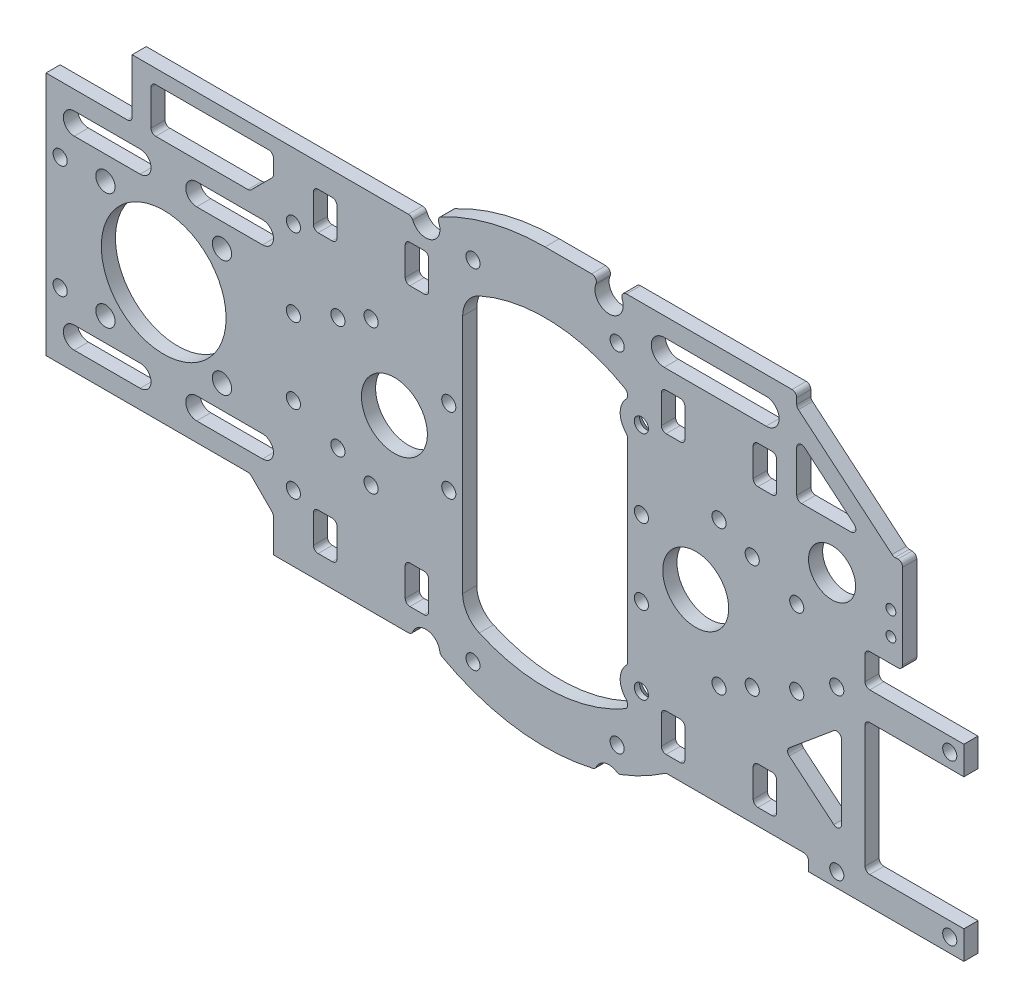
from build123d import *

# Parameters (mm, degrees)
SKETCH_1_R                  = 13.25
SKETCH_1_R_2                = 2.05
SKETCH_1_R_3                = 1.5
SKETCH_1_R_4                = 1.05
SKETCH_1_R_5                = 7
SKETCH_1_R_6                = 5
SKETCH_1_W                  = 5
SKETCH_1_H                  = 8
SKETCH_1_W_2                = 26
SKETCH_1_H_2                = 9.5
EXTRUDE_1_DEPTH             = 3
HOLE_WIZARD_M3_1_AT_2_COUNT = 2
HOLE_WIZARD_M3_1_AT_2_PITCH = 49
FILLET_2_R                  = 6
CHAMFER_1_SIZE              = 5
FILLET_1_R                  = 1
SKETCH_3_R                  = 3
CUT_EXTRUDE_1_DEPTH         = 10
FILLET_3_R                  = 1


with BuildPart() as part:
    # 草图1 → 凸台-拉伸1 (new body)
    with BuildSketch(Plane.XY):
        with BuildLine():
            Line((-106, -26), (-57.705, -26))
            Line((-57.705, -26), (-57.705, -38.5))
            Line((-57.705, -38.5), (-23.296995514, -38.5))
            ThreePointArc((-23.296995514, -38.5), (1.418755187, -44.977629259), (25.677121627, -36.9551813))
            Line((25.677121627, -36.9551813), (55.955, -36.9551813))
            Line((55.955, -36.9551813), (55.955, -39.9551813))
            Line((55.955, -39.9551813), (88.955, -39.9551813))
            Line((88.955, -39.9551813), (88.955, -33.9551813))
            Line((88.955, -33.9551813), (67.955, -33.9551813))
            Line((67.955, -33.9551813), (67.955, -22.9551813))
            Line((67.955, -22.9551813), (67.955, -6))
            Line((67.955, -6), (88.955, -6))
            Line((88.955, -6), (88.955, 0))
            Line((88.955, 0), (82.821810834, 0))
            Line((82.821810834, 0), (67.955, 0))
            Line((67.955, 0), (67.955, 7.0448187))
            Line((67.955, 7.0448187), (75.955, 7.0448187))
            Line((75.955, 7.0448187), (75.955, 12.0448187))
            Line((75.955, 12.0448187), (75.955, 27.0448187))
            Line((75.955, 27.0448187), (73.978938419, 27.0448187))
            Line((73.978938419, 27.0448187), (53.455, 44.266447857))
            Line((53.455, 44.266447857), (53.455, 47))
            Line((53.455, 47), (0, 47))
            ThreePointArc((0, 47), (-14.133294025, 44.824658392), (-26.958301133, 38.5))
            Line((-26.958301133, 38.5), (-57.705, 38.5))
            Line((-57.705, 38.5), (-87.705, 38.5))
            Line((-87.705, 38.5), (-87.705, 26))
            Line((-87.705, 26), (-106, 26))
            Line((-106, 26), (-106, -26))
        make_face()
        with Locations((-81, 0)):
            Circle(SKETCH_1_R, mode=Mode.SUBTRACT)
        with Locations((-93.374368671, 12.374368671)):
            Circle(SKETCH_1_R_2, mode=Mode.SUBTRACT)
        with Locations((-68.625631329, 12.374368671)):
            Circle(SKETCH_1_R_2, mode=Mode.SUBTRACT)
        with Locations((-68.625631329, -12.374368671)):
            Circle(SKETCH_1_R_2, mode=Mode.SUBTRACT)
        with Locations((-93.374368671, -12.374368671)):
            Circle(SKETCH_1_R_2, mode=Mode.SUBTRACT)
        with Locations((-20.455, 8)):
            Circle(SKETCH_1_R_3, mode=Mode.SUBTRACT)
        with Locations((-20.455, -8)):
            Circle(SKETCH_1_R_3, mode=Mode.SUBTRACT)
        with Locations((-53.455, 8)):
            Circle(SKETCH_1_R_3, mode=Mode.SUBTRACT)
        with Locations((-53.455, -8)):
            Circle(SKETCH_1_R_3, mode=Mode.SUBTRACT)
        with Locations(Location((20.455, -8, 0), (0, 0, 180))):
            Circle(SKETCH_1_R_3, mode=Mode.SUBTRACT)
        with Locations(Location((20.455, 8, 0), (0, 0, 180))):
            Circle(SKETCH_1_R_3, mode=Mode.SUBTRACT)
        with Locations(Location((53.455, -8, 0), (0, 0, 180))):
            Circle(SKETCH_1_R_3, mode=Mode.SUBTRACT)
        with Locations(Location((53.455, 8, 0), (0, 0, 180))):
            Circle(SKETCH_1_R_3, mode=Mode.SUBTRACT)
        with Locations((-36.955, 15.3)):
            Circle(SKETCH_1_R_3, mode=Mode.SUBTRACT)
        with Locations((-36.955, -15.3)):
            Circle(SKETCH_1_R_3, mode=Mode.SUBTRACT)
        with Locations(Location((36.955, -15.3, 0), (0, 0, 180))):
            Circle(SKETCH_1_R_3, mode=Mode.SUBTRACT)
        with Locations(Location((36.955, 15.3, 0), (0, 0, 180))):
            Circle(SKETCH_1_R_3, mode=Mode.SUBTRACT)
        with Locations((-15.307337295, 36.9551813)):
            Circle(SKETCH_1_R_3, mode=Mode.SUBTRACT)
        with Locations(Location((-15.307337295, -36.9551813, 0), (0, 0, 180))):
            Circle(SKETCH_1_R_3, mode=Mode.SUBTRACT)
        with Locations((15.307337295, -36.9551813)):
            Circle(SKETCH_1_R_3, mode=Mode.SUBTRACT)
        with Locations(Location((15.307337295, 36.9551813, 0), (0, 0, 180))):
            Circle(SKETCH_1_R_3, mode=Mode.SUBTRACT)
        with Locations((44, 12)):
            Circle(SKETCH_1_R_3, mode=Mode.SUBTRACT)
        with Locations((44, -12)):
            Circle(SKETCH_1_R_3, mode=Mode.SUBTRACT)
        with Locations((-44, 12)):
            Circle(SKETCH_1_R_3, mode=Mode.SUBTRACT)
        with Locations((-44, -12)):
            Circle(SKETCH_1_R_3, mode=Mode.SUBTRACT)
        with Locations((-53.455, 24.5)):
            Circle(SKETCH_1_R_3, mode=Mode.SUBTRACT)
        with Locations(Location((-53.455, -24.5, 0), (0, 0, 180))):
            Circle(SKETCH_1_R_3, mode=Mode.SUBTRACT)
        with Locations((20.455, -24.5)):
            Circle(SKETCH_1_R_3, mode=Mode.SUBTRACT)
        with Locations(Location((20.455, 24.5, 0), (0, 0, 180))):
            Circle(SKETCH_1_R_3, mode=Mode.SUBTRACT)
        with Locations((-103, 12)):
            Circle(SKETCH_1_R_3, mode=Mode.SUBTRACT)
        with Locations(Location((-103, -12, 0), (0, 0, 180))):
            Circle(SKETCH_1_R_3, mode=Mode.SUBTRACT)
        with Locations((61.955, -36.9551813)):
            Circle(SKETCH_1_R_3, mode=Mode.SUBTRACT)
        with Locations((61.955, -2.9551813)):
            Circle(SKETCH_1_R_3, mode=Mode.SUBTRACT)
        with Locations((73.455, 12)):
            Circle(SKETCH_1_R_4, mode=Mode.SUBTRACT)
        with Locations((73.455, 17)):
            Circle(SKETCH_1_R_4, mode=Mode.SUBTRACT)
        with Locations((85.955, -36.9551813)):
            Circle(SKETCH_1_R_3, mode=Mode.SUBTRACT)
        with Locations((85.955, -2.9551813)):
            Circle(SKETCH_1_R_3, mode=Mode.SUBTRACT)
        with Locations((32, 0)):
            Circle(SKETCH_1_R_5, mode=Mode.SUBTRACT)
        with Locations(Location((-32, 0, 0), (0, 0, 180))):
            Circle(SKETCH_1_R_5, mode=Mode.SUBTRACT)
        with Locations((60.955, 17.5448187)):
            Circle(SKETCH_1_R_6, mode=Mode.SUBTRACT)
        with BuildLine():
            Line((-17.5, 29.150471694), (-17.5, -29.150471694))
            ThreePointArc((-17.5, -29.150471694), (0, -34), (17.5, -29.150471694))
            Line((17.5, -29.150471694), (17.5, -27.893814226))
            ThreePointArc((17.5, -27.893814226), (15.955, -24.5), (17.5, -21.106185774))
            Line((17.5, -21.106185774), (17.5, 21.106185774))
            ThreePointArc((17.5, 21.106185774), (15.955, 24.5), (17.5, 27.893814226))
            Line((17.5, 27.893814226), (17.5, 29.150471694))
            ThreePointArc((17.5, 29.150471694), (0, 34), (-17.5, 29.150471694))
        make_face(mode=Mode.SUBTRACT)
        with Locations((-27.205, -29.5)):
            Rectangle(SKETCH_1_W, SKETCH_1_H, mode=Mode.SUBTRACT)
        with Locations((-46.705, -29.5)):
            Rectangle(SKETCH_1_W, SKETCH_1_H, mode=Mode.SUBTRACT)
        with Locations((-27.205, 29.5)):
            Rectangle(SKETCH_1_W, SKETCH_1_H, mode=Mode.SUBTRACT)
        with Locations((-46.705, 29.5)):
            Rectangle(SKETCH_1_W, SKETCH_1_H, mode=Mode.SUBTRACT)
        with Locations((27.205, 29.5)):
            Rectangle(SKETCH_1_W, SKETCH_1_H, mode=Mode.SUBTRACT)
        with Locations((46.705, 29.5)):
            Rectangle(SKETCH_1_W, SKETCH_1_H, mode=Mode.SUBTRACT)
        with Locations((27.205, -29.5)):
            Rectangle(SKETCH_1_W, SKETCH_1_H, mode=Mode.SUBTRACT)
        with Locations((46.705, -29.5)):
            Rectangle(SKETCH_1_W, SKETCH_1_H, mode=Mode.SUBTRACT)
        with BuildLine():
            Line((-100, 22), (-86, 22))
            ThreePointArc((-86, 22), (-83.687184335, 19.687184335), (-86, 17.374368671))
            Line((-86, 17.374368671), (-100, 17.374368671))
            ThreePointArc((-100, 17.374368671), (-102.312815665, 19.687184335), (-100, 22))
        make_face(mode=Mode.SUBTRACT)
        with BuildLine():
            Line((-74, 22), (-60, 22))
            ThreePointArc((-60, 22), (-57.687184335, 19.687184335), (-60, 17.374368671))
            Line((-60, 17.374368671), (-74, 17.374368671))
            ThreePointArc((-74, 17.374368671), (-76.312815665, 19.687184335), (-74, 22))
        make_face(mode=Mode.SUBTRACT)
        with BuildLine():
            Line((-100, -22), (-86, -22))
            ThreePointArc((-86, -22), (-83.687184335, -19.687184335), (-86, -17.374368671))
            Line((-86, -17.374368671), (-100, -17.374368671))
            ThreePointArc((-100, -17.374368671), (-102.312815665, -19.687184335), (-100, -22))
        make_face(mode=Mode.SUBTRACT)
        with BuildLine():
            Line((-74, -22), (-60, -22))
            ThreePointArc((-60, -22), (-57.687184335, -19.687184335), (-60, -17.374368671))
            Line((-60, -17.374368671), (-74, -17.374368671))
            ThreePointArc((-74, -17.374368671), (-76.312815665, -19.687184335), (-74, -22))
        make_face(mode=Mode.SUBTRACT)
        with BuildLine():
            Line((25.307337295, 43), (46.955, 43))
            ThreePointArc((46.955, 43), (49.705, 40.25), (46.955, 37.5))
            Line((46.955, 37.5), (25.307337295, 37.5))
            ThreePointArc((25.307337295, 37.5), (22.557337295, 40.25), (25.307337295, 43))
        make_face(mode=Mode.SUBTRACT)
        Polygon((53.455, 27.0448187), (67.756043111, 27.0448187), (53.455, 39.0448187), align=None, mode=Mode.SUBTRACT)
        with Locations((-70.705, 30.75)):
            Rectangle(SKETCH_1_W_2, SKETCH_1_H_2, mode=Mode.SUBTRACT)
        Polygon((62.955, -29.9551813), (62.955, -9.9551813), (50.955, -19.9551813), align=None, mode=Mode.SUBTRACT)
    extrude(amount=EXTRUDE_1_DEPTH)

    # 草图2 → M3 六角凹锥坑螺钉的锥形沉头孔1 (revolve, cut)
    with BuildSketch(Plane(origin=(20.455, -24.5, 0), x_dir=(0, 1, 0), z_dir=(1, 0, 0))):
        Polygon((0, 0), (0, 3), (1.5, 3), (1.5, 1.86), (3.36, 0), align=None)
    hole_wizard_m3_1 = revolve(axis=Axis((20.455, -24.5, -6.35), (0, 0, 1)), mode=Mode.SUBTRACT)

    # M3 六角凹锥坑螺钉的锥形沉头孔1 at 2: M3 六角凹锥坑螺钉的锥形沉头孔1 ×2
    with Locations(*[(0, i * HOLE_WIZARD_M3_1_AT_2_PITCH, 0) for i in range(1, HOLE_WIZARD_M3_1_AT_2_COUNT)]):
        add(hole_wizard_m3_1, mode=Mode.SUBTRACT)

    # 圆角2
    fillet_2_edges = [part.edges().sort_by_distance(p)[0] for p in [
        (-17.5, 29.150471694, 1.5),
        (-17.5, -29.150471694, 1.5),
        (-26.958301133, 38.5, 1.5),
    ]]
    fillet(fillet_2_edges, radius=FILLET_2_R)

    # 倒角1
    chamfer_1_edges = [part.edges().sort_by_distance(p)[0] for p in [
        (-57.705, 26, 1.5),
        (-57.705, -26, 1.5),
    ]]
    chamfer(chamfer_1_edges, length=CHAMFER_1_SIZE)

    # 圆角1
    fillet_1_edges = [part.edges().sort_by_distance(p)[0] for p in [
        (17.5, 29.150471694, 1.5),
        (17.5, -29.150471694, 1.5),
        (17.5, -27.893814226, 1.5),
        (17.5, -21.106185774, 1.5),
        (17.5, 21.106185774, 1.5),
        (17.5, 27.893814226, 1.5),
        (-49.205, -25.5, 1.5),
        (-49.205, -33.5, 1.5),
        (-44.205, -33.5, 1.5),
        (-44.205, -25.5, 1.5),
        (-29.705, -25.5, 1.5),
        (-29.705, -33.5, 1.5),
        (-24.705, -33.5, 1.5),
        (-24.705, -25.5, 1.5),
        (-29.705, 25.5, 1.5),
        (-24.705, 25.5, 1.5),
        (-24.705, 33.5, 1.5),
        (-29.705, 33.5, 1.5),
        (-44.205, 25.5, 1.5),
        (-44.205, 33.5, 1.5),
        (-49.205, 33.5, 1.5),
        (-49.205, 25.5, 1.5),
        (29.705, 25.5, 1.5),
        (29.705, 33.5, 1.5),
        (24.705, 33.5, 1.5),
        (24.705, 25.5, 1.5),
        (44.205, 25.5, 1.5),
        (49.205, 25.5, 1.5),
        (49.205, 33.5, 1.5),
        (44.205, 33.5, 1.5),
        (29.705, -25.5, 1.5),
        (24.705, -25.5, 1.5),
        (24.705, -33.5, 1.5),
        (29.705, -33.5, 1.5),
        (44.205, -25.5, 1.5),
        (44.205, -33.5, 1.5),
        (49.205, -33.5, 1.5),
        (49.205, -25.5, 1.5),
        (-57.705, 35.5, 1.5),
        (-83.705, 35.5, 1.5),
        (-83.705, 26, 1.5),
        (53.455, 39.0448187, 1.5),
        (53.455, 27.0448187, 1.5),
        (67.756043111, 27.0448187, 1.5),
        (50.955, -19.9551813, 1.5),
        (62.955, -29.9551813, 1.5),
        (62.955, -9.9551813, 1.5),
        (-87.705, 26, 1.5),
        (53.455, 47, 1.5),
        (53.455, 44.266447857, 1.5),
        (73.978938419, 27.0448187, 1.5),
        (75.955, 27.0448187, 1.5),
        (75.955, 7.0448187, 1.5),
        (67.955, 7.0448187, 1.5),
        (67.955, 0, 1.5),
        (67.955, -6, 1.5),
        (67.955, -33.9551813, 1.5),
        (55.955, -36.9551813, 1.5),
        (25.677121627, -36.9551813, 1.5),
        (-23.296995514, -38.5, 1.5),
        (-62.705, 26, 1.5),
        (-57.705, 31, 1.5),
        (-57.705, -31, 1.5),
        (-62.705, -26, 1.5),
    ]]
    fillet(fillet_1_edges, radius=FILLET_1_R)

    # 草图3 → 切除-拉伸1 (cut)
    with BuildSketch(Plane(origin=(0, 0, 0), x_dir=(-1, 0, 0), z_dir=(0, 0, -1))):
        with Locations((25.325715128, 38.998181409)):
            Circle(SKETCH_3_R)
        with Locations((-13.59528427, 44.468171152)):
            Circle(SKETCH_3_R)
        with Locations((-13.59528427, -44.468171152)):
            Circle(SKETCH_3_R)
        with Locations((25.325715128, -38.998181409)):
            Circle(SKETCH_3_R)
    extrude(amount=-CUT_EXTRUDE_1_DEPTH, mode=Mode.SUBTRACT)

    # 圆角3
    fillet_3_edges = [part.edges().sort_by_distance(p)[0] for p in [
        (15.204583088, 47, 1.5),
        (11.985985452, 47, 1.5),
        (-23.053917161, 40.957501188, 1.5),
        (-28.287507535, 38.520912366, 1.5),
        (15.578671157, -42.217354311, 1.5),
        (10.692341214, -43.711255294, 1.5),
        (-22.326592878, -39.070746736, 1.5),
        (-28.284061843, -38.5, 1.5),
    ]]
    fillet(fillet_3_edges, radius=FILLET_3_R)


solid = part.part
